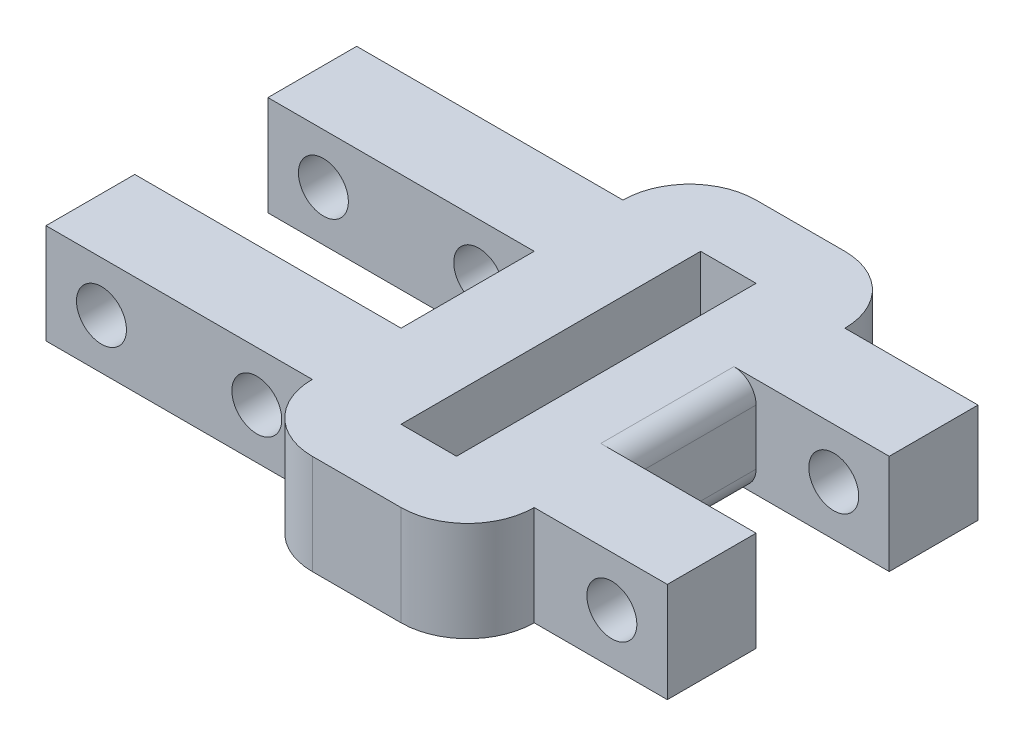
from build123d import *

# Parameters (mm, degrees)
CROQUIS1_W                 = 2.5
CROQUIS1_H                 = 13.5
SALIENTE_EXTRUIR1_DEPTH    = 4.5
CORTAR_EXTRUIR4_DEPTH      = 10
CORTAR_EXTRUIR4_DEPTH_BACK = 23.169799277
CROQUIS7_R                 = 1.125
REDONDEO3_R                = 1


with BuildPart() as part:
    # Croquis1 → Saliente-Extruir1 (new body)
    with BuildSketch(Plane(origin=(0, 0, 0), x_dir=(1, 0, 0), z_dir=(0, 1, 0))):
        with BuildLine():
            Line((-2, -10), (2, -10))
            ThreePointArc((2, -10), (4.121320344, -9.121320344), (5, -7))
            Line((5, -7), (11, -7))
            Line((11, -7), (11, -3))
            Line((11, -3), (5, -3))
            Line((5, -3), (5, 3))
            Line((5, 3), (11, 3))
            Line((11, 3), (11, 7))
            Line((11, 7), (5, 7))
            ThreePointArc((5, 7), (4.121320344, 9.121320344), (2, 10))
            Line((2, 10), (-2, 10))
            ThreePointArc((-2, 10), (-4.121320344, 9.121320344), (-5, 7))
            Line((-5, 7), (-17, 7))
            Line((-17, 7), (-17, 3))
            Line((-17, 3), (-5, 3))
            Line((-5, 3), (-5, -3))
            Line((-5, -3), (-17, -3))
            Line((-17, -3), (-17, -7))
            Line((-17, -7), (-5, -7))
            ThreePointArc((-5, -7), (-4.121320344, -9.121320344), (-2, -10))
        make_face()
        Rectangle(CROQUIS1_W, CROQUIS1_H, mode=Mode.SUBTRACT)
    extrude(amount=SALIENTE_EXTRUIR1_DEPTH)

    # Croquis7 → Cortar-Extruir4 (cut, two sides: drawn at the far end of the back side and taken through both)
    with BuildSketch(Plane.XY.offset(3.5).offset(-CORTAR_EXTRUIR4_DEPTH_BACK)):
        with Locations(Location((-14.5, 2.25, 0), (0, 0, 180))):
            Circle(CROQUIS7_R)
        with Locations(Location((8.5, 2.25, 0), (0, 0, 180))):
            Circle(CROQUIS7_R)
        with Locations(Location((-7.5, 2.25, 0), (0, 0, 180))):
            Circle(CROQUIS7_R)
    extrude(amount=CORTAR_EXTRUIR4_DEPTH + CORTAR_EXTRUIR4_DEPTH_BACK, mode=Mode.SUBTRACT)

    # Redondeo3
    redondeo3_edges = [part.edges().sort_by_distance(p)[0] for p in [
        (5, 0, 0),
        (5, 4.5, 0),
    ]]
    fillet(redondeo3_edges, radius=REDONDEO3_R)


solid = part.part
